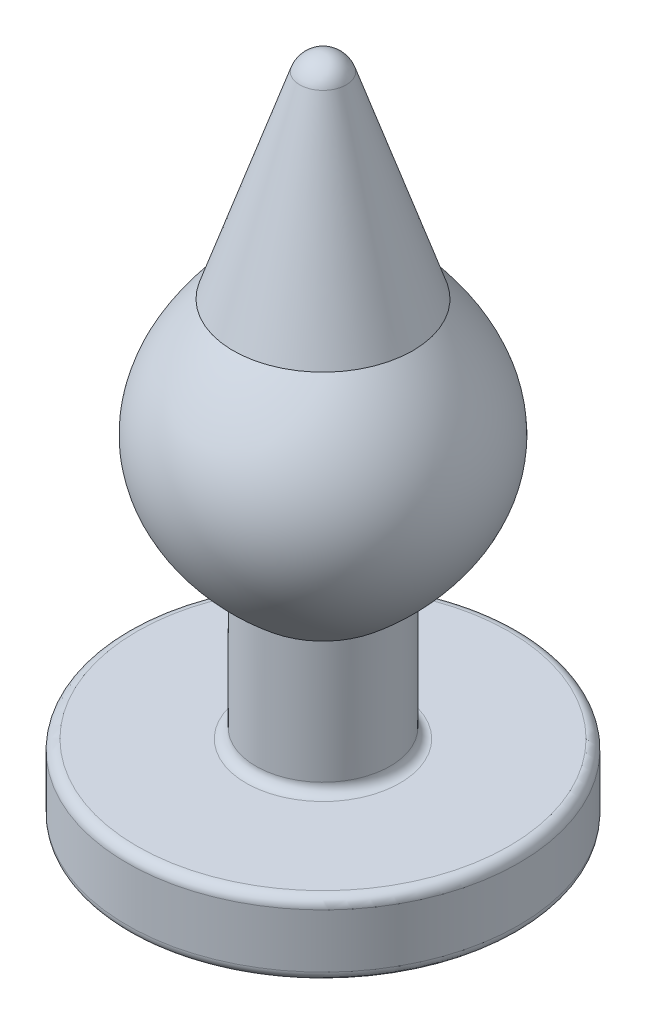
from build123d import *


with BuildPart() as part:
    # Sketch1 → Revolve3 (revolve)
    with BuildSketch(Plane.XY, mode=Mode.PRIVATE) as revolve3_sk:
        with BuildLine():
            Line((3.007394206, 42.751736158), (11.652189651, 17.21165811))
            add(Edge.make_bspline(
                [(11.652189651, 17.21165811), (27.092047712, 0.077628738), (8.704480068, -15.086904856)],
                knots=[0, 0, 0, 1, 1, 1], degree=2))
            Line((8.704480068, -15.086904856), (8.704480068, -30.938794565))
            ThreePointArc((8.704480068, -30.938794565), (9.076454456, -31.836820177), (9.974480068, -32.208794565))
            Line((9.974480068, -32.208794565), (24.13, -32.208794565))
            ThreePointArc((24.13, -32.208794565), (25.028025612, -32.580768953), (25.4, -33.478794565))
            Line((25.4, -33.478794565), (25.4, -40.463794565))
            ThreePointArc((25.4, -40.463794565), (25.028025612, -41.361820177), (24.13, -41.733794565))
            Line((24.13, -41.733794565), (0, -41.733794565))
            Line((0, -41.733794565), (0, 44.908794565))
            ThreePointArc((0, 44.908794565), (1.850494588, 44.313774173), (3.007394206, 42.751736158))
        make_face()
    revolve(revolve3_sk.sketch.rotate(Axis((0, 44.908794565, 0), (0, -1, 0)), 180), axis=Axis((0, 44.908794565, 0), (0, -1, 0)))


solid = part.part
